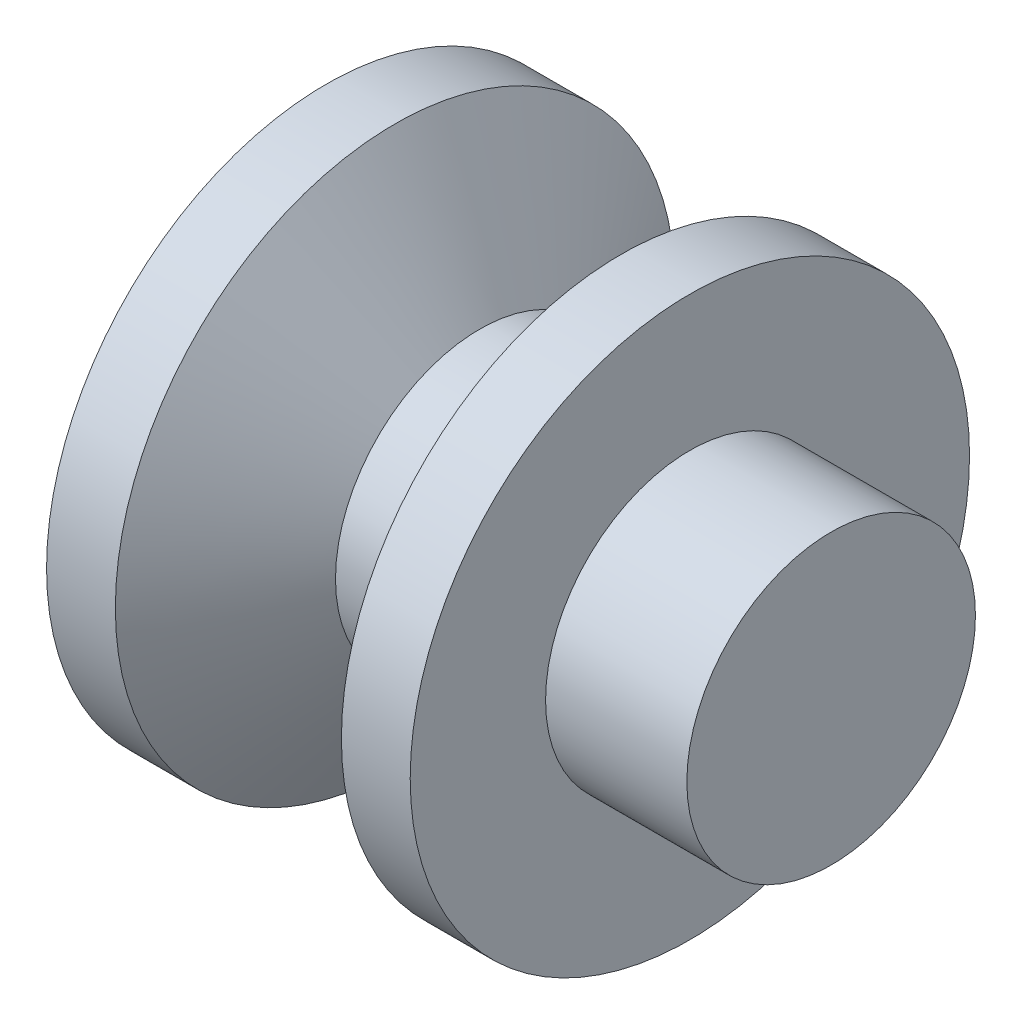
from build123d import *


with BuildPart() as part:
    # 草圖1 → 旋轉1 (revolve)
    with BuildSketch(Plane.XY, mode=Mode.PRIVATE) as revolve_1_sk:
        Polygon((0, 0), (0, 19.795), (4.87, 19.795), (10.87, 10.213858447), (14.87, 10.213858447), (20.87, 19.795), (25.74, 19.795), (25.74, 10.213858447), (35.74, 10.213858447), (35.74, 0), align=None)
    revolve(revolve_1_sk.sketch.rotate(Axis((-743.15639781, 0, 0), (1, 0, 0)), 90), axis=Axis((-743.15639781, 0, 0), (1, 0, 0)))


solid = part.part
